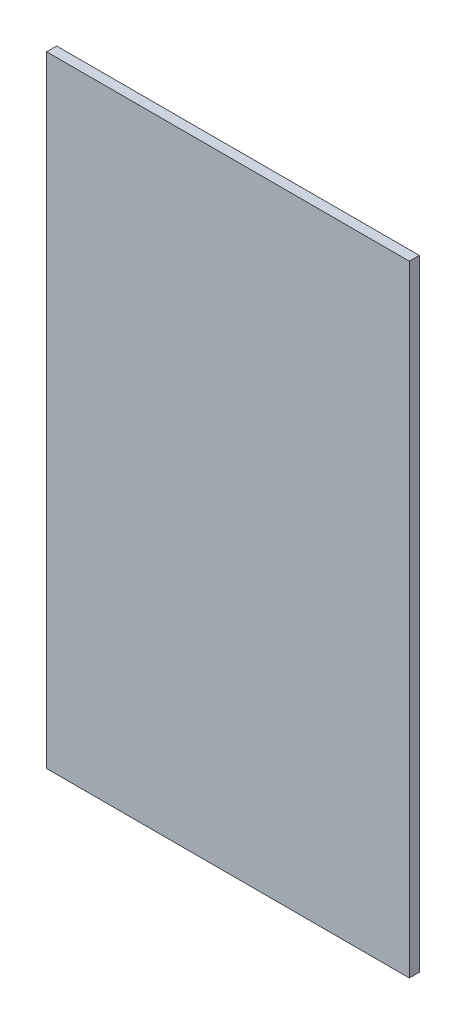
from build123d import *

# Parameters (mm, degrees)
SKETCH1_W           = 460.12277982
SKETCH1_H           = 787.4
BOSS_EXTRUDE1_DEPTH = 12.7


with BuildPart() as part:
    # Sketch1 → Boss-Extrude1 (new body)
    with BuildSketch(Plane.XY):
        with Locations((230.06138991, 393.7)):
            Rectangle(SKETCH1_W, SKETCH1_H)
    extrude(amount=BOSS_EXTRUDE1_DEPTH)


solid = part.part
